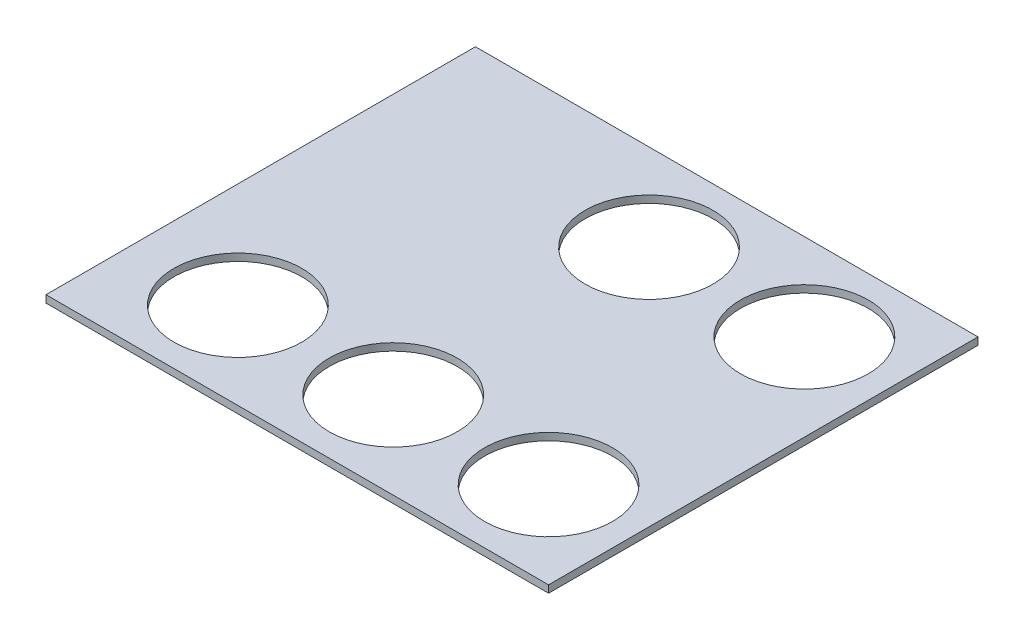
from build123d import *

# Parameters (mm, degrees)
SKETCH1_W           = 550
SKETCH1_H           = 470
BOSS_EXTRUDE1_DEPTH = 8
SKETCH2_R           = 70
CUT_EXTRUDE5_DEPTH  = 8


with BuildPart() as part:
    # Sketch1 → Boss-Extrude1 (new body)
    with BuildSketch(Plane(origin=(0, 0, 0), x_dir=(1, 0, 0), z_dir=(0, 1, 0))):
        with Locations((275, 235)):
            Rectangle(SKETCH1_W, SKETCH1_H)
    extrude(amount=BOSS_EXTRUDE1_DEPTH)

    # Sketch2 → Cut-Extrude5 (cut)
    with BuildSketch(Plane(origin=(0, 0, 0), x_dir=(1, 0, 0), z_dir=(0, 1, 0))):
        with Locations(Location((455, 95, 0), (0, 0, 270))):
            Circle(SKETCH2_R)
        with Locations(Location((285, 95, 0), (0, 0, 270))):
            Circle(SKETCH2_R)
        with Locations(Location((115, 95, 0), (0, 0, 270))):
            Circle(SKETCH2_R)
        with Locations(Location((455, 375, 0), (0, 0, 270))):
            Circle(SKETCH2_R)
        with Locations(Location((285, 375, 0), (0, 0, 270))):
            Circle(SKETCH2_R)
    extrude(amount=CUT_EXTRUDE5_DEPTH, mode=Mode.SUBTRACT)


solid = part.part
